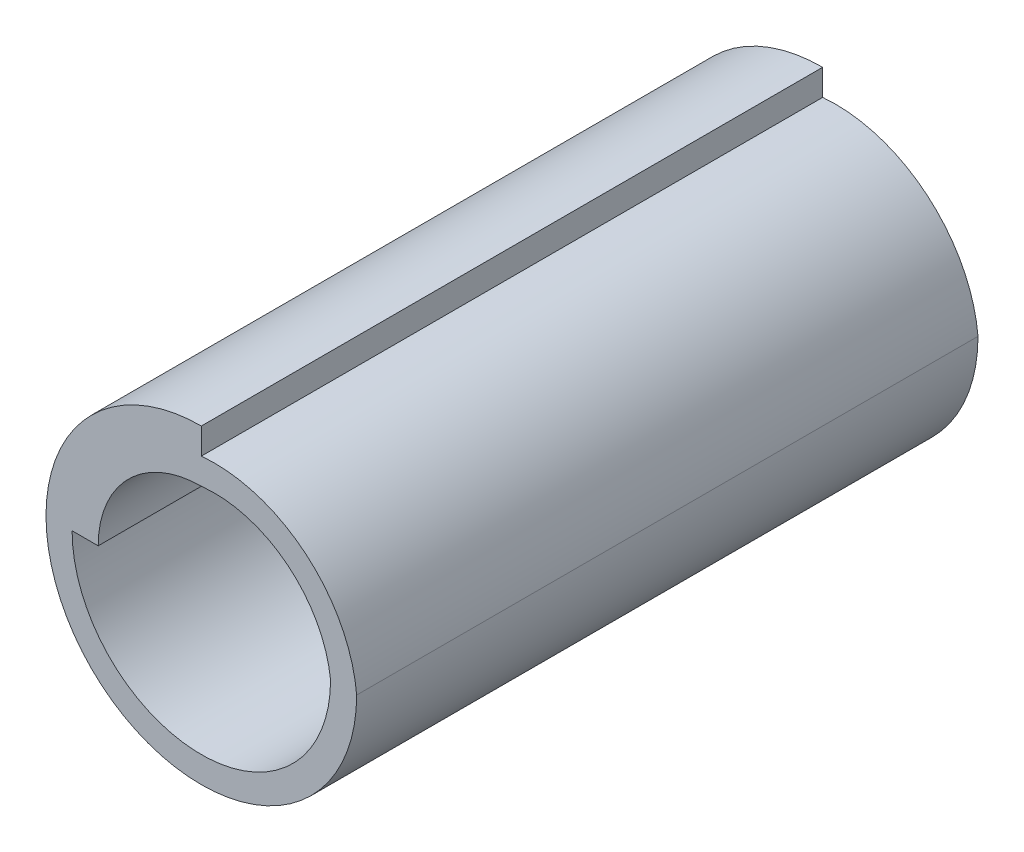
from build123d import *

# Parameters (mm, degrees)
BASE_EXTRUDE_DEPTH = 10


with BuildPart() as part:
    # Sketch1 → Base-Extrude (new, symmetric)
    with BuildSketch(Plane.XY):
        with BuildLine():
            Line((0, 4.16), (0, 5))
            ThreePointArc((0, 5), (-3.535533906, -3.535533906), (5, 0))
            ThreePointArc((5, 0), (3.36156421, 3.115533906), (0, 4.16))
        make_face()
        with BuildLine():
            Line((-4.16, 0), (-3.32, 0))
            ThreePointArc((-3.32, 0), (-2.347594514, 2.347594514), (0, 3.32))
            ThreePointArc((0, 3.32), (2.767594514, 2.52156421), (4.16, 0))
            ThreePointArc((4.16, 0), (0, -4.16), (-4.16, 0))
        make_face(mode=Mode.SUBTRACT)
    extrude(amount=BASE_EXTRUDE_DEPTH, both=True)


solid = part.part
